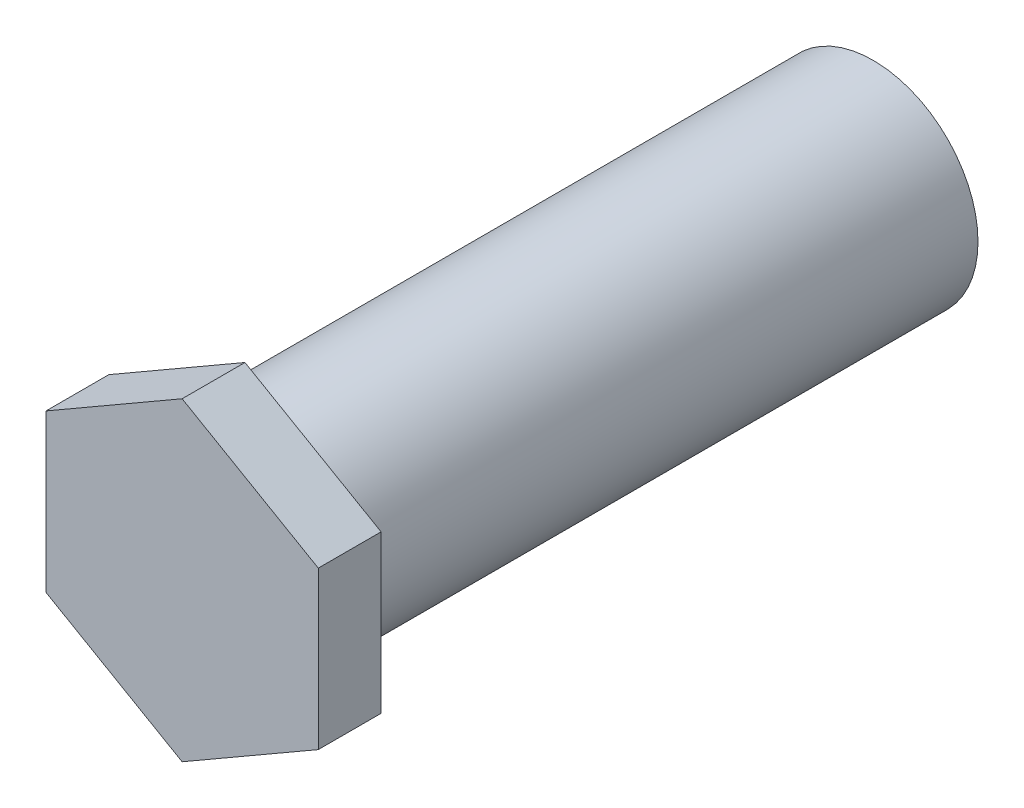
from build123d import *

# Parameters (mm, degrees)
SKETCH1_R           = 5
BOSS_EXTRUDE1_DEPTH = 30
BOSS_EXTRUDE2_DEPTH = 3


with BuildPart() as part:
    # Sketch1 → Boss-Extrude1 (new body)
    with BuildSketch(Plane.XY):
        Circle(SKETCH1_R)
    extrude(amount=-BOSS_EXTRUDE1_DEPTH)

    # Sketch2 → Boss-Extrude2 (add)
    with BuildSketch(Plane.XY):
        Polygon((-6.5, -3.75277675), (0, -7.505553499), (6.5, -3.75277675), (6.5, 3.75277675), (0, 7.505553499), (-6.5, 3.75277675), align=None)
    extrude(amount=BOSS_EXTRUDE2_DEPTH)


solid = part.part
